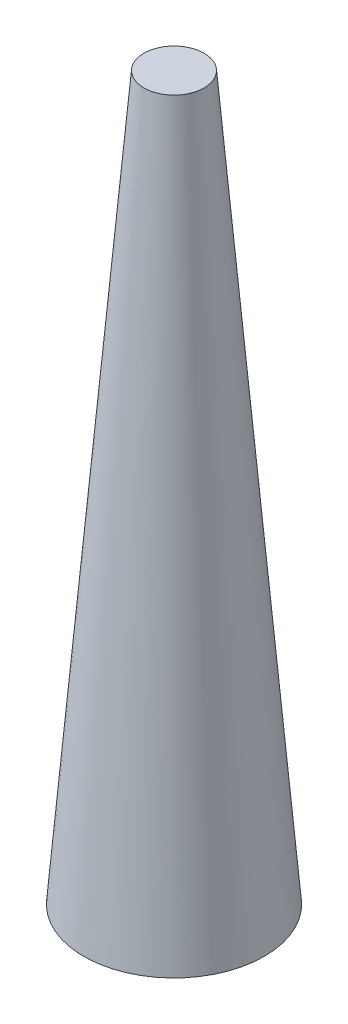
from build123d import *


with BuildPart() as part:
    # Sketch1 → Revolve1 (revolve)
    with BuildSketch(Plane.XY, mode=Mode.PRIVATE) as revolve1_sk:
        Polygon((0, 0), (-19.05, 0), (-6.35, 152.4), (0, 152.4), align=None)
    revolve(revolve1_sk.sketch.rotate(Axis((0, 152.4, 0), (0, -1, 0)), 180), axis=Axis((0, 152.4, 0), (0, -1, 0)))


solid = part.part
